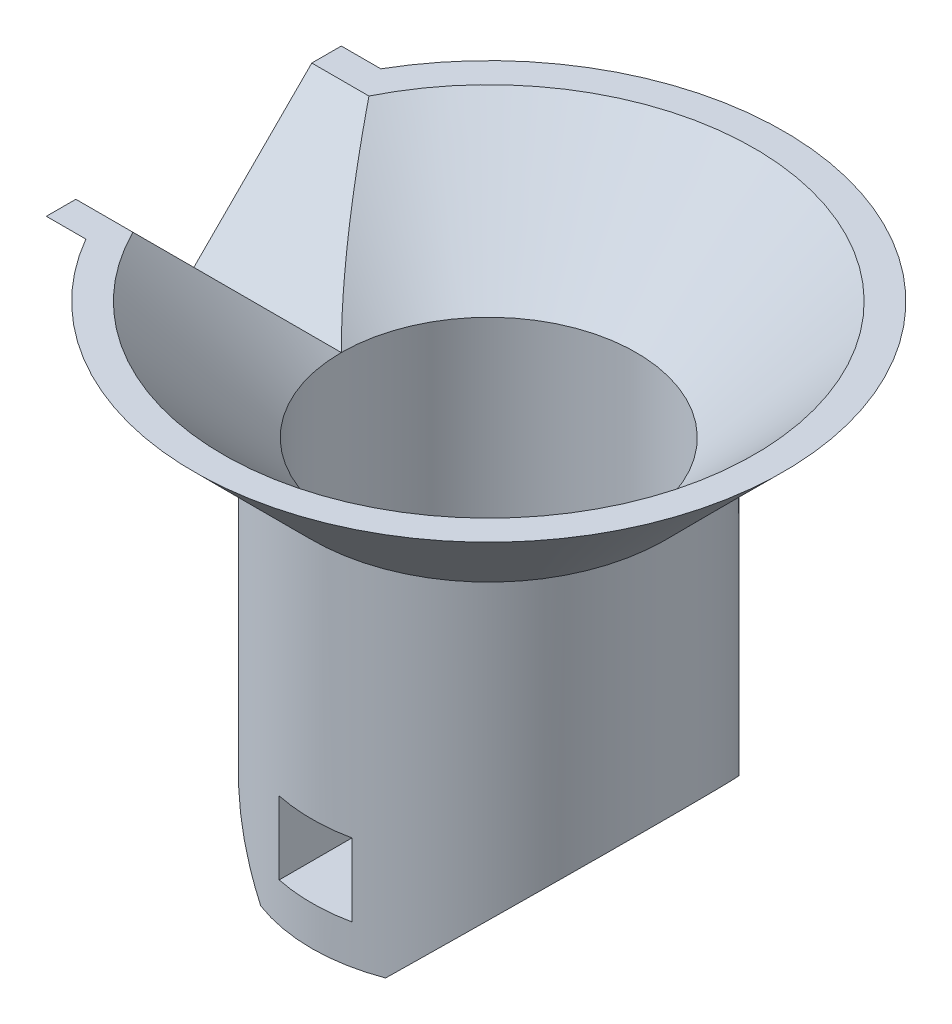
from build123d import *

# Parameters (mm, degrees)
SKETCH1_R               = 9
BOSS_EXTRUDE1_DEPTH     = 18
CUT_EXTRUDE1_DEPTH      = 23.045407685
CUT_EXTRUDE1_DEPTH_BACK = 23.045407685
SKETCH2_W               = 3.7
SKETCH2_H               = 3.7
CUT_EXTRUDE2_START      = -11.3
SKETCH3_R               = 7.5
CUT_EXTRUDE2_DEPTH      = 11.3
CUT_EXTRUDE3_DEPTH      = 33.031234756
BOSS_EXTRUDE2_REACH     = 43.243
BOSS_EXTRUDE4_DEPTH     = 0.75


with BuildPart() as part:
    # Sketch1 → Boss-Extrude1 (new body)
    with BuildSketch(Plane(origin=(0, 0, 0), x_dir=(1, 0, 0), z_dir=(0, 1, 0))):
        with Locations(Location((0, 0, 0), (0, 0, 270))):
            Circle(SKETCH1_R)
    extrude(amount=BOSS_EXTRUDE1_DEPTH)

    # Sketch2 → Cut-Extrude1 (cut, two sides: drawn at the far end of the back side and taken through both)
    with BuildSketch(Plane.XY.offset(-CUT_EXTRUDE1_DEPTH_BACK)):
        Polygon((-9, 5.7), (-3.175, 0), (-9, 0), align=None)
        Polygon((3.175, 0), (9, 5.7), (9, 0), align=None)
        with Locations((0, 3.85)):
            Rectangle(SKETCH2_W, SKETCH2_H)
    extrude(amount=CUT_EXTRUDE1_DEPTH + CUT_EXTRUDE1_DEPTH_BACK, mode=Mode.SUBTRACT)

    # Sketch3 → Cut-Extrude2 (cut)
    with BuildSketch(Plane(origin=(0, 18, 0), x_dir=(1, 0, 0), z_dir=(0, 1, 0)).offset(CUT_EXTRUDE2_START)):
        with Locations(Location((0, 0, 0), (0, 0, 270))):
            Circle(SKETCH3_R)
    extrude(amount=CUT_EXTRUDE2_DEPTH, mode=Mode.SUBTRACT)

    # Sketch4 → Revolve1 (revolve)
    with BuildSketch(Plane.XY):
        Polygon((9, 18), (15, 24), (13.5, 24), (7.5, 18), align=None)
    revolve(axis=Axis((0, -14.513203436, 0), (0, 1, 0)))

    # Sketch5 → Cut-Extrude3 (cut, through all)
    with BuildSketch(Plane(origin=(0, 0, 0), x_dir=(0, 0, -1), z_dir=(1, 0, 0))):
        Polygon((0, 18), (-6, 24), (6, 24), align=None)
    extrude(amount=-CUT_EXTRUDE3_DEPTH, mode=Mode.SUBTRACT)

    # Sketch6 → Boss-Extrude2 (add, up to next)
    with BuildSketch(Plane(origin=(-15, 0, 0), x_dir=(0, 0, -1), z_dir=(1, 0, 0)), mode=Mode.PRIVATE) as boss_extrude2_sk1:
        Polygon((6, 24), (0, 18), (-6, 24), (-7.5, 24), (0, 16.5), (7.5, 24), align=None)
    boss_extrude2_tool1 = extrude(boss_extrude2_sk1.sketch, amount=BOSS_EXTRUDE2_REACH, mode=Mode.PRIVATE) - part.part
    add(boss_extrude2_tool1.solids().sort_by_distance((-15, 20.881415, -3.118585))[0])

    # Sketch7 → Boss-Extrude4 (add, symmetric)
    with BuildSketch(Plane.XY):
        Polygon((-15, 18), (-15, 16.5), (-7.5, 9), (-7.5, 18), align=None)
    extrude(amount=BOSS_EXTRUDE4_DEPTH, both=True)


solid = part.part
